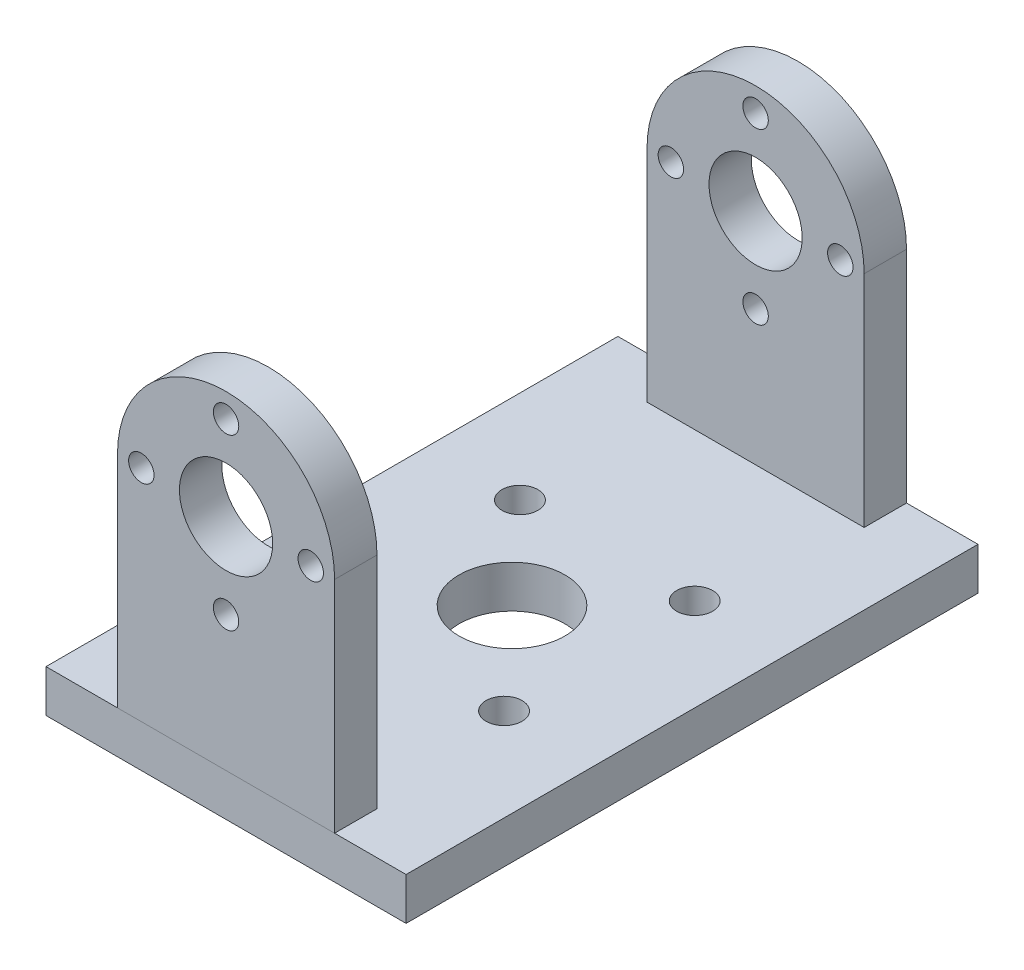
from build123d import *

# Parameters (mm, degrees)
SKETCH1_R           = 1.2
SKETCH1_R_2         = 4.4
BOSS_EXTRUDE1_DEPTH = 4
SKETCH3_W           = 34
SKETCH3_H           = 46
SKETCH3_R           = 5
SKETCH3_R_2         = 1.7
BOSS_EXTRUDE3_DEPTH = 4
SKETCH4_R           = 1.7
SKETCH4_R_2         = 5
BOSS_EXTRUDE4_DEPTH = 4
SKETCH5_W           = 46
SKETCH5_H           = 4
CUT_EXTRUDE1_DEPTH  = 65.020016401
SKETCH6_W           = 34
SKETCH6_H           = 4
BOSS_EXTRUDE5_DEPTH = 4
SKETCH7_R           = 4.4
SKETCH7_R_2         = 1.2
BOSS_EXTRUDE6_DEPTH = 4
SKETCH8_W           = 46
SKETCH8_H           = 31
SKETCH8_W_2         = 4
SKETCH8_H_2         = 4
CUT_EXTRUDE2_DEPTH  = 67.951941719


with BuildPart() as part:
    # Sketch1 → Boss-Extrude1 (new body)
    with BuildSketch(Plane.XY):
        with BuildLine():
            Line((-10.25, -28.75), (10.25, -28.75))
            Line((10.25, -28.75), (10.25, 0))
            ThreePointArc((10.25, 0), (0, 10.25), (-10.25, 0))
            Line((-10.25, 0), (-10.25, -28.75))
        make_face()
        with Locations((0, 8)):
            Circle(SKETCH1_R, mode=Mode.SUBTRACT)
        with Locations((-8, 0)):
            Circle(SKETCH1_R, mode=Mode.SUBTRACT)
        with Locations((0, -8)):
            Circle(SKETCH1_R, mode=Mode.SUBTRACT)
        with Locations((8, 0)):
            Circle(SKETCH1_R, mode=Mode.SUBTRACT)
        Circle(SKETCH1_R_2, mode=Mode.SUBTRACT)
    boss_extrude1 = extrude(amount=BOSS_EXTRUDE1_DEPTH)

    # Sketch3 → Boss-Extrude3 (add)
    with BuildSketch(Plane(origin=(0, -28.75, 0), x_dir=(-1, 0, 0), z_dir=(0, -1, 0))):
        with Locations((0, -23)):
            Rectangle(SKETCH3_W, SKETCH3_H)
        with Locations(Location((0, -23, 0), (0, 0, 180))):
            Circle(SKETCH3_R, mode=Mode.SUBTRACT)
        with Locations(Location((-8.25, -14, 0), (0, 0, 180))):
            Circle(SKETCH3_R_2, mode=Mode.SUBTRACT)
        with Locations(Location((8.25, -14, 0), (0, 0, 180))):
            Circle(SKETCH3_R_2, mode=Mode.SUBTRACT)
        with Locations(Location((8.25, -32, 0), (0, 0, 180))):
            Circle(SKETCH3_R_2, mode=Mode.SUBTRACT)
        with Locations(Location((-8.25, -32, 0), (0, 0, 180))):
            Circle(SKETCH3_R_2, mode=Mode.SUBTRACT)
    extrude(amount=-BOSS_EXTRUDE3_DEPTH)

    # Mirror1: Boss-Extrude1 across plane
    add(boss_extrude1.mirror(Plane.XY.offset(23)))

    # Sketch4 → Boss-Extrude4 (add)
    with BuildSketch(Plane(origin=(0, -24.75, 0), x_dir=(1, 0, 0), z_dir=(0, 1, 0))):
        Polygon((-10.25, -42), (10.25, -42), (10.25, -46), (17, -46), (17, 0), (10.25, 0), (10.25, -4), (-10.25, -4), (-10.25, 0), (-17, 0), (-17, -46), (-10.25, -46), align=None)
        with Locations((8.25, -14)):
            Circle(SKETCH4_R, mode=Mode.SUBTRACT)
        with Locations((-8.25, -32)):
            Circle(SKETCH4_R, mode=Mode.SUBTRACT)
        with Locations((8.25, -32)):
            Circle(SKETCH4_R, mode=Mode.SUBTRACT)
        with Locations((-8.25, -14)):
            Circle(SKETCH4_R, mode=Mode.SUBTRACT)
        with Locations((0, -23)):
            Circle(SKETCH4_R_2, mode=Mode.SUBTRACT)
    extrude(amount=BOSS_EXTRUDE4_DEPTH)

    # Sketch5 → Cut-Extrude1 (cut, through all)
    with BuildSketch(Plane.ZY.offset(17)):
        with Locations((23, -26.75)):
            Rectangle(SKETCH5_W, SKETCH5_H)
    extrude(amount=-CUT_EXTRUDE1_DEPTH, mode=Mode.SUBTRACT)

    # Sketch6 → Boss-Extrude5 (add)
    with BuildSketch(Plane(origin=(0, -20.75, 0), x_dir=(1, 0, 0), z_dir=(0, 1, 0))):
        with Locations((0, 2)):
            Rectangle(SKETCH6_W, SKETCH6_H)
        with Locations((0, -48)):
            Rectangle(SKETCH6_W, SKETCH6_H)
    extrude(amount=-BOSS_EXTRUDE5_DEPTH)

    # Mirror2: Boss-Extrude1 across plane
    add(boss_extrude1.mirror(Plane(origin=(0, 0, 0), x_dir=(1, 0, 0), z_dir=(0, 0, -1))))

    # Sketch8 → Cut-Extrude2 (cut, through all)
    with BuildSketch(Plane(origin=(17, 0, 0), x_dir=(0, 0, -1), z_dir=(1, 0, 0))):
        with Locations((-23, -5.25)):
            Rectangle(SKETCH8_W, SKETCH8_H)
        with Locations((2, -26.75)):
            Rectangle(SKETCH8_W_2, SKETCH8_H_2)
    extrude(amount=-CUT_EXTRUDE2_DEPTH, mode=Mode.SUBTRACT)


with BuildPart() as body_2:
    # Sketch7 → Boss-Extrude6 (new body)
    with BuildSketch(Plane.XY.offset(46)):
        with BuildLine():
            Line((10.25, -20.75), (-10.25, -20.75))
            Line((-10.25, -20.75), (-10.25, 0))
            ThreePointArc((-10.25, 0), (0, 10.25), (10.25, 0))
            Line((10.25, 0), (10.25, -20.75))
        make_face()
        Circle(SKETCH7_R, mode=Mode.SUBTRACT)
        with Locations((8, 0)):
            Circle(SKETCH7_R_2, mode=Mode.SUBTRACT)
        with Locations((0, -8)):
            Circle(SKETCH7_R_2, mode=Mode.SUBTRACT)
        with Locations((-8, 0)):
            Circle(SKETCH7_R_2, mode=Mode.SUBTRACT)
        with Locations((0, 8)):
            Circle(SKETCH7_R_2, mode=Mode.SUBTRACT)
    extrude(amount=BOSS_EXTRUDE6_DEPTH)


solid = Compound([part.part, body_2.part])
